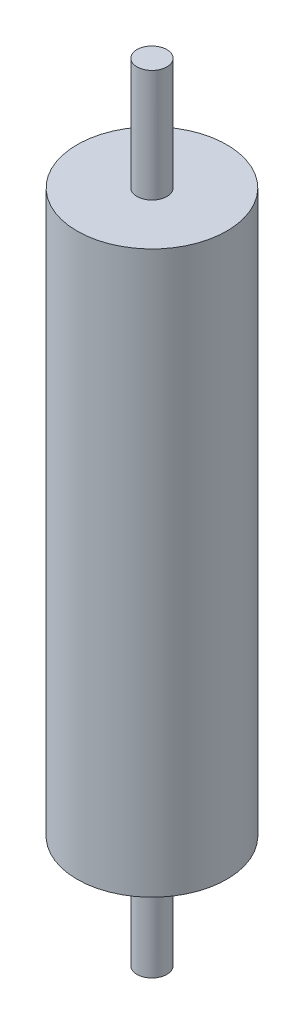
from build123d import *

# Parameters (mm, degrees)
SKETCH1_R           = 20
BOSS_EXTRUDE1_DEPTH = 150
SKETCH2_R           = 4
BOSS_EXTRUDE2_DEPTH = 30


with BuildPart() as part:
    # Sketch1 → Boss-Extrude1 (new body)
    with BuildSketch(Plane(origin=(0, 0, 0), x_dir=(1, 0, 0), z_dir=(0, 1, 0))):
        with Locations(Location((0, 0, 0), (0, 0, 270))):
            Circle(SKETCH1_R)
    extrude(amount=BOSS_EXTRUDE1_DEPTH)

    # Sketch2 → Boss-Extrude2 (add)
    with BuildSketch(Plane.XZ):
        with Locations(Location((0, 0, 0), (0, 0, 90))):
            Circle(SKETCH2_R)
    boss_extrude2 = extrude(amount=BOSS_EXTRUDE2_DEPTH)

    # Mirror1: Boss-Extrude2 across plane
    add(boss_extrude2.mirror(Plane(origin=(0, 75, 0), x_dir=(0, 0, 1), z_dir=(0, -1, 0))))


solid = part.part
